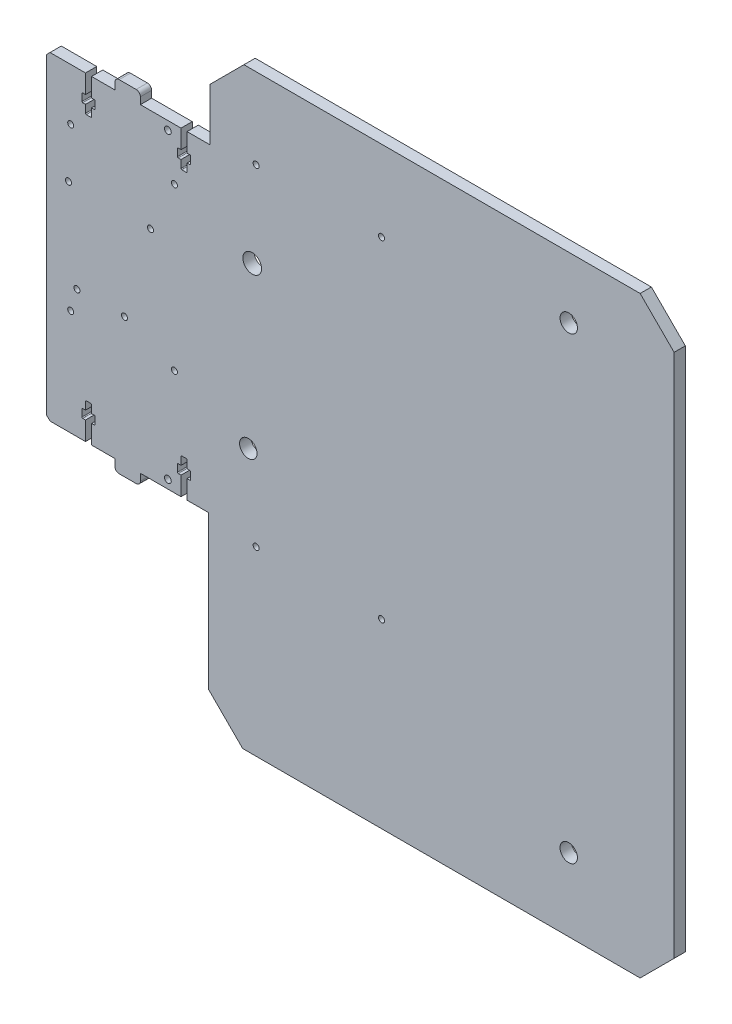
from build123d import *

# Parameters (mm, degrees)
MODEL_R             = 1.775
MODEL_R_2           = 5.5
MODEL_R_3           = 2
MODEL_R_4           = 5.125
BOSS_EXTRUDE1_DEPTH = 6.6


with BuildPart() as part:
    # Model → Boss-Extrude1 (new body)
    with BuildSketch(Plane.XY):
        with BuildLine():
            Line((40.15, 110.14), (40.15, 106.14))
            ThreePointArc((40.15, 106.14), (40.882233047, 104.372233047), (42.65, 103.64))
            Line((42.65, 103.64), (52.65, 103.64))
            ThreePointArc((52.65, 103.64), (54.417766953, 104.372233047), (55.15, 106.14))
            Line((55.15, 106.14), (55.15, 110.14))
            Line((55.15, 110.14), (79.05, 110.14))
            Line((79.05, 110.14), (79.05, 121.14))
            Line((79.05, 121.14), (77.465, 121.14))
            ThreePointArc((77.465, 121.14), (77.111446609, 121.286446609), (76.965, 121.64))
            Line((76.965, 121.64), (76.965, 125.64))
            ThreePointArc((76.965, 125.64), (77.111446609, 125.993553391), (77.465, 126.14))
            Line((77.465, 126.14), (79.05, 126.14))
            Line((79.05, 126.14), (79.05, 130.64))
            ThreePointArc((79.05, 130.64), (79.196446609, 130.993553391), (79.55, 131.14))
            Line((79.55, 131.14), (82.1, 131.14))
            ThreePointArc((82.1, 131.14), (82.453553391, 130.993553391), (82.6, 130.64))
            Line((82.6, 130.64), (82.6, 126.14))
            Line((82.6, 126.14), (84.185, 126.14))
            ThreePointArc((84.185, 126.14), (84.538553391, 125.993553391), (84.685, 125.64))
            Line((84.685, 125.64), (84.685, 121.64))
            ThreePointArc((84.685, 121.64), (84.538553391, 121.286446609), (84.185, 121.14))
            Line((84.185, 121.14), (82.6, 121.14))
            Line((82.6, 121.14), (82.6, 110.14))
            Line((82.6, 110.14), (95.3, 110.14))
            Line((95.3, 110.14), (95.3, 20))
            Line((95.3, 20), (115.3, 0))
            Line((115.3, 0), (349.1, 0))
            Line((349.1, 0), (369.1, 20))
            Line((369.1, 20), (369.1, 328.72))
            Line((369.1, 328.72), (349.1, 348.72))
            Line((349.1, 348.72), (116.05, 348.72))
            Line((116.05, 348.72), (96.05, 328.72))
            Line((96.05, 328.72), (96.05, 297.92))
            Line((96.05, 297.92), (82.6, 297.92))
            Line((82.6, 297.92), (82.6, 286.92))
            Line((82.6, 286.92), (84.185, 286.92))
            ThreePointArc((84.185, 286.92), (84.538553391, 286.773553391), (84.685, 286.42))
            Line((84.685, 286.42), (84.685, 282.42))
            ThreePointArc((84.685, 282.42), (84.538553391, 282.066446609), (84.185, 281.92))
            Line((84.185, 281.92), (82.6, 281.92))
            Line((82.6, 281.92), (82.6, 277.42))
            ThreePointArc((82.6, 277.42), (82.453553391, 277.066446609), (82.1, 276.92))
            Line((82.1, 276.92), (79.55, 276.92))
            ThreePointArc((79.55, 276.92), (79.196446609, 277.066446609), (79.05, 277.42))
            Line((79.05, 277.42), (79.05, 281.92))
            Line((79.05, 281.92), (77.465, 281.92))
            ThreePointArc((77.465, 281.92), (77.111446609, 282.066446609), (76.965, 282.42))
            Line((76.965, 282.42), (76.965, 286.42))
            ThreePointArc((76.965, 286.42), (77.111446609, 286.773553391), (77.465, 286.92))
            Line((77.465, 286.92), (79.05, 286.92))
            Line((79.05, 286.92), (79.05, 297.92))
            Line((79.05, 297.92), (55.15, 297.92))
            Line((55.15, 297.92), (55.15, 301.92))
            ThreePointArc((55.15, 301.92), (54.417766953, 303.687766953), (52.65, 304.42))
            Line((52.65, 304.42), (42.65, 304.42))
            ThreePointArc((42.65, 304.42), (40.882233047, 303.687766953), (40.15, 301.92))
            Line((40.15, 301.92), (40.15, 297.92))
            Line((40.15, 297.92), (26.41, 297.92))
            Line((26.41, 297.92), (26.41, 286.92))
            Line((26.41, 286.92), (27.995, 286.92))
            ThreePointArc((27.995, 286.92), (28.348553391, 286.773553391), (28.495, 286.42))
            Line((28.495, 286.42), (28.495, 282.42))
            ThreePointArc((28.495, 282.42), (28.348553391, 282.066446609), (27.995, 281.92))
            Line((27.995, 281.92), (26.41, 281.92))
            Line((26.41, 281.92), (26.41, 277.42))
            ThreePointArc((26.41, 277.42), (26.263553391, 277.066446609), (25.91, 276.92))
            Line((25.91, 276.92), (23.36, 276.92))
            ThreePointArc((23.36, 276.92), (23.006446609, 277.066446609), (22.86, 277.42))
            Line((22.86, 277.42), (22.86, 281.92))
            Line((22.86, 281.92), (21.275, 281.92))
            ThreePointArc((21.275, 281.92), (20.921446609, 282.066446609), (20.775, 282.42))
            Line((20.775, 282.42), (20.775, 286.42))
            ThreePointArc((20.775, 286.42), (20.921446609, 286.773553391), (21.275, 286.92))
            Line((21.275, 286.92), (22.86, 286.92))
            Line((22.86, 286.92), (22.86, 297.92))
            Line((22.86, 297.92), (2, 297.92))
            Line((2, 297.92), (0, 295.92))
            Line((0, 295.92), (0, 112.14))
            Line((0, 112.14), (2, 110.14))
            Line((2, 110.14), (22.86, 110.14))
            Line((22.86, 110.14), (22.86, 121.14))
            Line((22.86, 121.14), (21.275, 121.14))
            ThreePointArc((21.275, 121.14), (20.921446609, 121.286446609), (20.775, 121.64))
            Line((20.775, 121.64), (20.775, 125.64))
            ThreePointArc((20.775, 125.64), (20.921446609, 125.993553391), (21.275, 126.14))
            Line((21.275, 126.14), (22.86, 126.14))
            Line((22.86, 126.14), (22.86, 130.64))
            ThreePointArc((22.86, 130.64), (23.006446609, 130.993553391), (23.36, 131.14))
            Line((23.36, 131.14), (25.91, 131.14))
            ThreePointArc((25.91, 131.14), (26.263553391, 130.993553391), (26.41, 130.64))
            Line((26.41, 130.64), (26.41, 126.14))
            Line((26.41, 126.14), (27.995, 126.14))
            ThreePointArc((27.995, 126.14), (28.348553391, 125.993553391), (28.495, 125.64))
            Line((28.495, 125.64), (28.495, 121.64))
            ThreePointArc((28.495, 121.64), (28.348553391, 121.286446609), (27.995, 121.14))
            Line((27.995, 121.14), (26.41, 121.14))
            Line((26.41, 121.14), (26.41, 110.14))
            Line((26.41, 110.14), (40.15, 110.14))
        make_face()
        with Locations((123.225, 301.35)):
            Circle(MODEL_R, mode=Mode.SUBTRACT)
        with Locations((196.975, 301.35)):
            Circle(MODEL_R, mode=Mode.SUBTRACT)
        with Locations((123.225, 106.69)):
            Circle(MODEL_R, mode=Mode.SUBTRACT)
        with Locations((196.975, 106.69)):
            Circle(MODEL_R, mode=Mode.SUBTRACT)
        with Locations((120.924806781, 249.972001664)):
            Circle(MODEL_R_2, mode=Mode.SUBTRACT)
        with Locations((17.84, 185.23)):
            Circle(MODEL_R, mode=Mode.SUBTRACT)
        with Locations((45.79, 185.23)):
            Circle(MODEL_R, mode=Mode.SUBTRACT)
        with Locations((61.09, 237.62)):
            Circle(MODEL_R, mode=Mode.SUBTRACT)
        with Locations((12.84, 237.62)):
            Circle(MODEL_R, mode=Mode.SUBTRACT)
        with Locations((14.175, 172.42)):
            Circle(MODEL_R, mode=Mode.SUBTRACT)
        with Locations((75.175, 172.42)):
            Circle(MODEL_R, mode=Mode.SUBTRACT)
        with Locations((14.175, 267.42)):
            Circle(MODEL_R, mode=Mode.SUBTRACT)
        with Locations((75.175, 267.42)):
            Circle(MODEL_R, mode=Mode.SUBTRACT)
        with Locations((71.3, 292.92)):
            Circle(MODEL_R_3, mode=Mode.SUBTRACT)
        with Locations((71.3, 115.14)):
            Circle(MODEL_R_3, mode=Mode.SUBTRACT)
        with Locations((307.1, 312.72)):
            Circle(MODEL_R_4, mode=Mode.SUBTRACT)
        with Locations((118.629064244, 154.525625)):
            Circle(MODEL_R_4, mode=Mode.SUBTRACT)
        with Locations((307.1, 42.845)):
            Circle(MODEL_R_4, mode=Mode.SUBTRACT)
    extrude(amount=BOSS_EXTRUDE1_DEPTH)


solid = part.part
